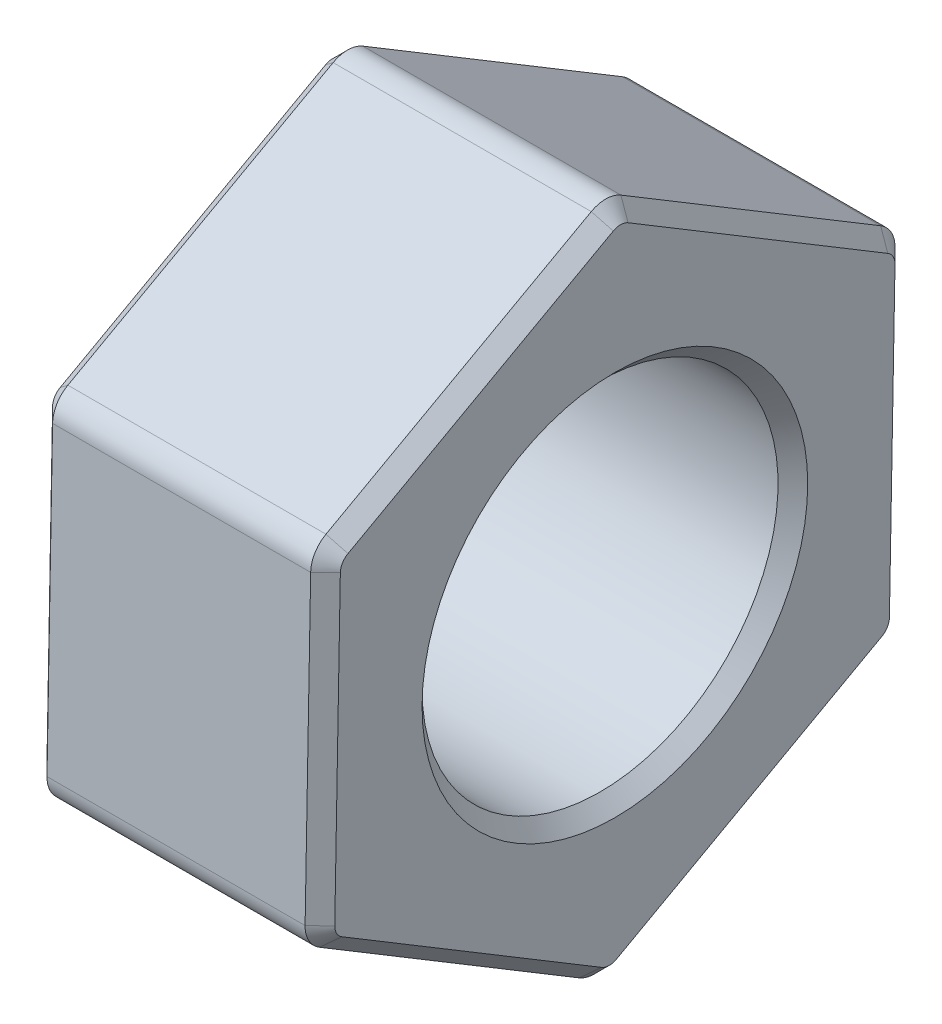
from build123d import *

# Parameters (mm, degrees)
SKETCH1_R           = 3
BOSS_EXTRUDE1_DEPTH = 4.85
CHAMFER1_SIZE       = 0.25


with BuildPart() as part:
    # Sketch1 → Boss-Extrude1 (new body)
    with BuildSketch(Plane(origin=(0, 0, 0), x_dir=(0, 0, -1), z_dir=(1, 0, 0))):
        with BuildLine():
            Line((4.729124762, 2.901358129), (0.351828076, 5.537031425))
            ThreePointArc((0.351828076, 5.537031425), (0.103101508, 5.608602318), (-0.148087464, 5.546221245))
            Line((-0.148087464, 5.546221245), (-4.619295838, 3.073207764))
            ThreePointArc((-4.619295838, 3.073207764), (-4.805641333, 2.893589685), (-4.877212226, 2.644863117))
            Line((-4.877212226, 2.644863117), (-4.971123914, -2.463823661))
            ThreePointArc((-4.971123914, -2.463823661), (-4.908742841, -2.715012633), (-4.729124762, -2.901358129))
            Line((-4.729124762, -2.901358129), (-0.351828076, -5.537031425))
            ThreePointArc((-0.351828076, -5.537031425), (-0.103101508, -5.608602318), (0.148087464, -5.546221245))
            Line((0.148087464, -5.546221245), (4.619295838, -3.073207764))
            ThreePointArc((4.619295838, -3.073207764), (4.805641333, -2.893589685), (4.877212226, -2.644863117))
            Line((4.877212226, -2.644863117), (4.971123914, 2.463823661))
            ThreePointArc((4.971123914, 2.463823661), (4.908742841, 2.715012633), (4.729124762, 2.901358129))
        make_face()
        Circle(SKETCH1_R, mode=Mode.SUBTRACT)
    extrude(amount=BOSS_EXTRUDE1_DEPTH)

    # Chamfer1
    chamfer1_edges = [part.edges().sort_by_distance(p)[0] for p in [
        (4.85, 5.608602318, -0.103101508),
        (0, -0.090519728, -4.92416807),
        (0, -2.893589685, -4.805641333),
        (0, -4.309714505, -2.383691651),
        (0, -5.608602318, 0.103101508),
        (0, -4.219194777, 2.540476419),
        (0, -2.715012633, 4.908742841),
        (4.85, 4.309714505, 2.383691651),
        (0, 0.090519728, 4.92416807),
        (0, 2.893589685, 4.805641333),
        (0, 4.309714505, 2.383691651),
        (0, 5.608602318, -0.103101508),
        (0, 4.219194777, -2.540476419),
        (0, 2.715012633, -4.908742841),
        (4.85, 2.893589685, 4.805641333),
        (4.85, 0.090519728, 4.92416807),
        (4.85, -2.715012633, 4.908742841),
        (4.85, -4.219194777, 2.540476419),
        (4.85, -5.608602318, 0.103101508),
        (0, 0, 3),
        (4.85, 0, 3),
        (4.85, -4.309714505, -2.383691651),
        (4.85, -2.893589685, -4.805641333),
        (4.85, -0.090519728, -4.92416807),
        (4.85, 2.715012633, -4.908742841),
        (4.85, 4.219194777, -2.540476419),
    ]]
    chamfer(chamfer1_edges, length=CHAMFER1_SIZE)


solid = part.part
